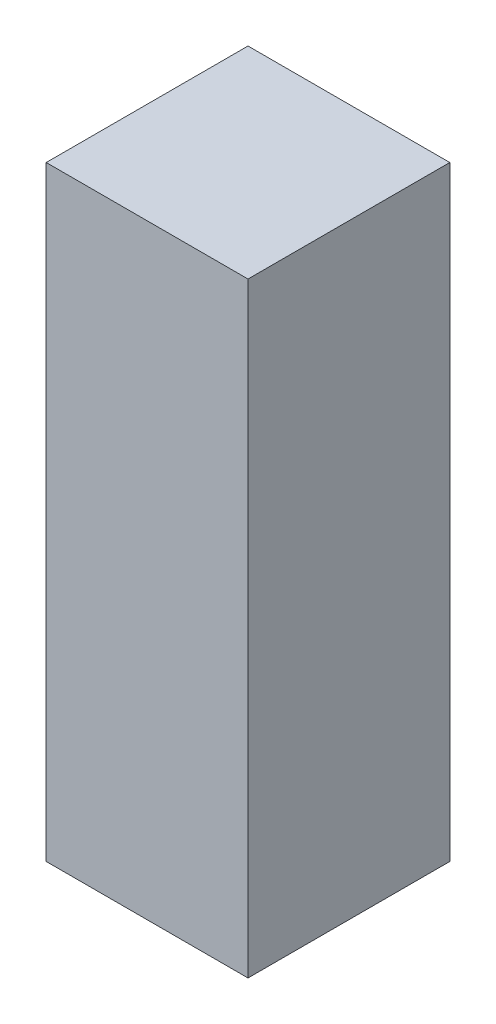
from build123d import *

# Parameters (mm, degrees)
CROQUIS1_W              = 5
CROQUIS1_H              = 15
SALIENTE_EXTRUIR1_DEPTH = 5


with BuildPart() as part:
    # Croquis1 → Saliente-Extruir1 (new body)
    with BuildSketch(Plane.XY):
        Rectangle(CROQUIS1_W, CROQUIS1_H)
    extrude(amount=SALIENTE_EXTRUIR1_DEPTH)


solid = part.part
